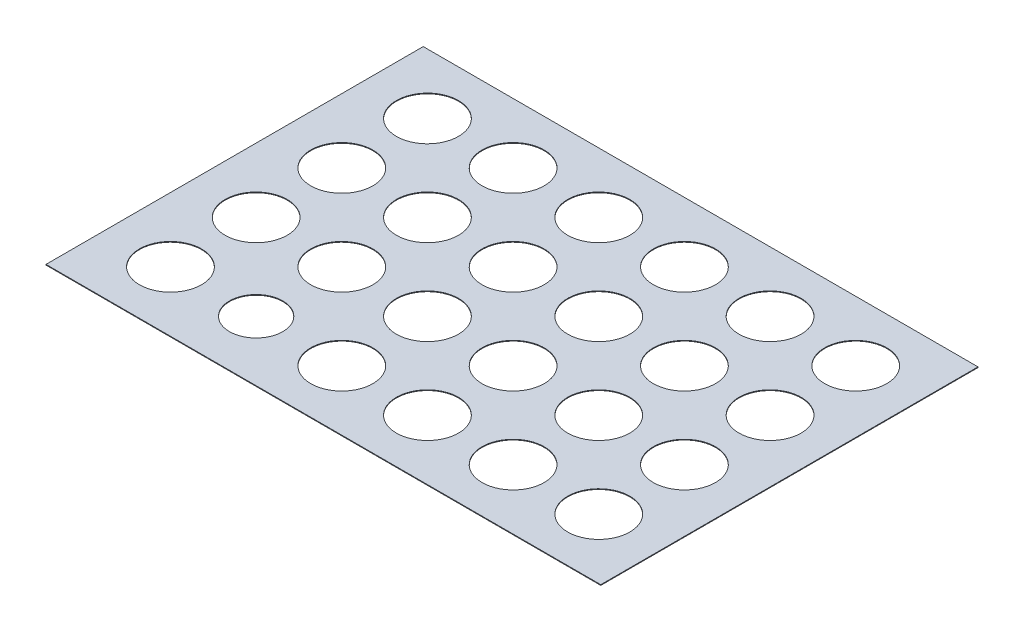
from build123d import *

# Parameters (mm, degrees)
SKETCH1_W           = 125
SKETCH1_H           = 85
BOSS_EXTRUDE1_DEPTH = 0.15
SKETCH2_R           = 7
SKETCH2_R_2         = 6.005641262
CUT_EXTRUDE1_DEPTH  = 0.15


with BuildPart() as part:
    # Sketch1 → Boss-Extrude1 (new body)
    with BuildSketch(Plane(origin=(0, 0, 0), x_dir=(1, 0, 0), z_dir=(0, 1, 0))):
        with Locations((62.5, 42.5)):
            Rectangle(SKETCH1_W, SKETCH1_H)
    extrude(amount=BOSS_EXTRUDE1_DEPTH)

    # Sketch2 → Cut-Extrude1 (cut)
    with BuildSketch(Plane(origin=(0, 0.15, 0), x_dir=(1, 0, 0), z_dir=(0, 1, 0))):
        with Locations(Location((14.5, 13.55, 0), (0, 0, 270))):
            Circle(SKETCH2_R)
        with Locations(Location((14.5, 32.85, 0), (0, 0, 270))):
            Circle(SKETCH2_R)
        with Locations(Location((14.5, 52.15, 0), (0, 0, 270))):
            Circle(SKETCH2_R)
        with Locations(Location((14.5, 71.45, 0), (0, 0, 270))):
            Circle(SKETCH2_R)
        with Locations(Location((33.8, 71.45, 0), (0, 0, 270))):
            Circle(SKETCH2_R)
        with Locations(Location((53.1, 71.45, 0), (0, 0, 270))):
            Circle(SKETCH2_R)
        with Locations(Location((72.4, 71.45, 0), (0, 0, 270))):
            Circle(SKETCH2_R)
        with Locations(Location((91.7, 71.45, 0), (0, 0, 270))):
            Circle(SKETCH2_R)
        with Locations(Location((111, 71.45, 0), (0, 0, 270))):
            Circle(SKETCH2_R)
        with Locations(Location((33.8, 52.15, 0), (0, 0, 270))):
            Circle(SKETCH2_R)
        with Locations(Location((33.8, 32.85, 0), (0, 0, 270))):
            Circle(SKETCH2_R)
        with Locations(Location((53.1, 52.15, 0), (0, 0, 270))):
            Circle(SKETCH2_R)
        with Locations(Location((53.1, 32.85, 0), (0, 0, 270))):
            Circle(SKETCH2_R)
        with Locations(Location((72.4, 52.15, 0), (0, 0, 270))):
            Circle(SKETCH2_R)
        with Locations(Location((91.7, 52.15, 0), (0, 0, 270))):
            Circle(SKETCH2_R)
        with Locations(Location((111, 52.15, 0), (0, 0, 270))):
            Circle(SKETCH2_R)
        with Locations(Location((72.4, 32.85, 0), (0, 0, 270))):
            Circle(SKETCH2_R)
        with Locations(Location((91.7, 32.85, 0), (0, 0, 270))):
            Circle(SKETCH2_R)
        with Locations(Location((111, 32.85, 0), (0, 0, 270))):
            Circle(SKETCH2_R)
        with Locations(Location((33.8, 13.55, 0), (0, 0, 270))):
            Circle(SKETCH2_R_2)
        with Locations(Location((53.1, 13.55, 0), (0, 0, 270))):
            Circle(SKETCH2_R)
        with Locations(Location((72.4, 13.55, 0), (0, 0, 270))):
            Circle(SKETCH2_R)
        with Locations(Location((91.7, 13.55, 0), (0, 0, 270))):
            Circle(SKETCH2_R)
        with Locations(Location((111, 13.55, 0), (0, 0, 270))):
            Circle(SKETCH2_R)
    extrude(amount=-CUT_EXTRUDE1_DEPTH, mode=Mode.SUBTRACT)


solid = part.part
